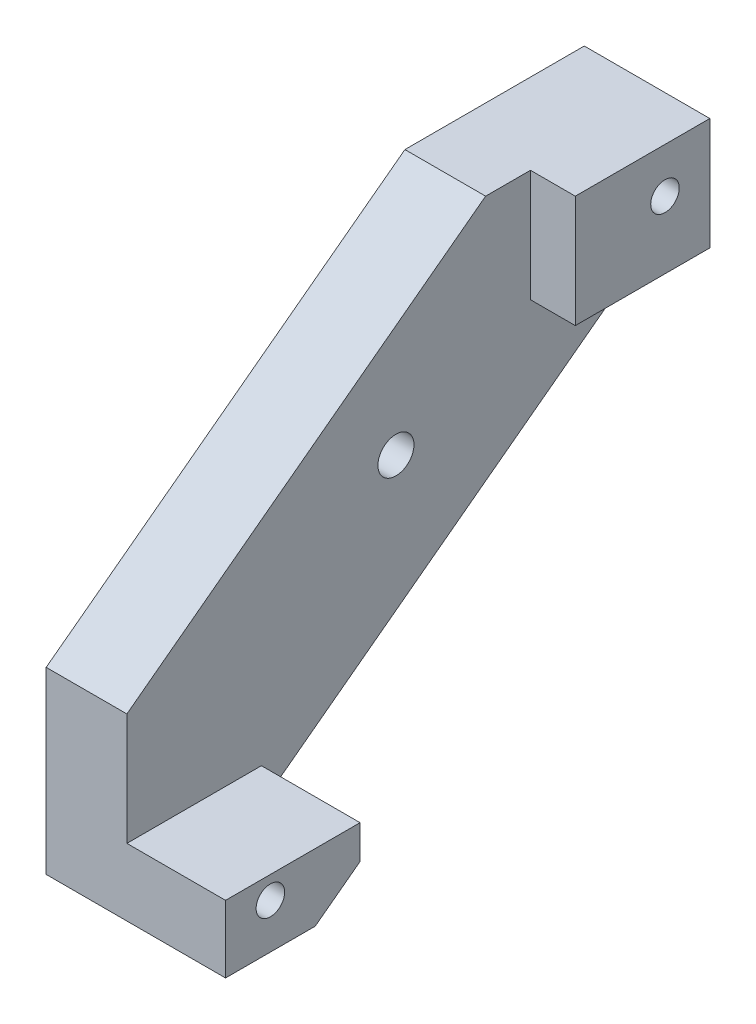
from build123d import *

# Parameters (mm, degrees)
SKETCH1_W                   = 76.2
SKETCH1_H                   = 63.5
BOSS_EXTRUDE1_DEPTH         = 25.4
SKETCH2_W                   = 38.1
SKETCH2_H                   = 63.5
CUT_EXTRUDE1_DEPTH          = 13.97
F_1_4_20_TAPPED_HOLE1_D     = 5.1054
F_1_4_20_TAPPED_HOLE1_DEPTH = 19.05
F_1_4_20_TAPPED_HOLE1_TIP   = 1.533816902
LPATTERN1_COUNT             = 2
LPATTERN1_PITCH             = 50.8
LPATTERN1_COUNT_DIR2        = 2
LPATTERN1_PITCH_DIR2        = 63.5
SKETCH7_W                   = 76.2
SKETCH7_H                   = 38.1
CUT_EXTRUDE2_DEPTH          = 13.97
SKETCH8_OUTSIDE_W           = 98.678
SKETCH8_OUTSIDE_H           = 85.978
CUT_EXTRUDE3_DEPTH          = 56.72102386
SKETCH9_W                   = 7.62
SKETCH9_H                   = 15.875
CUT_EXTRUDE4_DEPTH          = 87.36933773


with BuildPart() as part:
    # Sketch1 → Boss-Extrude1 (new body)
    with BuildSketch(Plane(origin=(0, 0, 0), x_dir=(0, 0, -1), z_dir=(1, 0, 0))):
        Rectangle(SKETCH1_W, SKETCH1_H)
    extrude(amount=BOSS_EXTRUDE1_DEPTH)

    # Sketch2 → Cut-Extrude1 (cut)
    with BuildSketch(Plane(origin=(25.4, 0, 0), x_dir=(0, 0, -1), z_dir=(1, 0, 0))):
        Rectangle(SKETCH2_W, SKETCH2_H)
    extrude(amount=-CUT_EXTRUDE1_DEPTH, mode=Mode.SUBTRACT)

    # Sketch5 → #10-32 Tapped Hole1 (revolve, cut)
    with BuildSketch(Plane(origin=(25.4, 25.4, 31.75), x_dir=(0, 0, -1), z_dir=(0, 1, 0))):
        Polygon((0, 0), (0, 14.929317848), (2.0193, 13.716), (2.0193, 0), align=None)
    f_10_32_tapped_hole1 = revolve(axis=Axis((31.75, 25.4, 31.75), (-1, 0, 0)), mode=Mode.SUBTRACT)

    # 1/4-20 Tapped Hole1
    with Locations(Plane(origin=(11.43, 0, 0), x_dir=(0, 0, -1), z_dir=(1, 0, 0))):
        with Locations((0, 6.35)):
            Hole(F_1_4_20_TAPPED_HOLE1_D / 2, depth=F_1_4_20_TAPPED_HOLE1_DEPTH)
            with Locations((0, 0, -(F_1_4_20_TAPPED_HOLE1_DEPTH + F_1_4_20_TAPPED_HOLE1_TIP / 2))):  # 118° drill point
                Cone(0, F_1_4_20_TAPPED_HOLE1_D / 2, F_1_4_20_TAPPED_HOLE1_TIP, mode=Mode.SUBTRACT)

    # LPattern1: 10-32 Tapped Hole1 2 × 2
    with Locations(*[(0, -i * LPATTERN1_PITCH, -j * LPATTERN1_PITCH_DIR2) for i in range(LPATTERN1_COUNT) for j in range(LPATTERN1_COUNT_DIR2) if (i, j) != (0, 0)]):
        add(f_10_32_tapped_hole1, mode=Mode.SUBTRACT)

    # Sketch7 → Cut-Extrude2 (cut)
    with BuildSketch(Plane(origin=(25.4, 0, 0), x_dir=(0, 0, -1), z_dir=(1, 0, 0))):
        with Locations((0, -3.175)):
            Rectangle(SKETCH7_W, SKETCH7_H)
    extrude(amount=-CUT_EXTRUDE2_DEPTH, mode=Mode.SUBTRACT)

    # Sketch8 outside → Cut-Extrude3 (cut, through all)
    with BuildSketch(Plane.ZY):
        Rectangle(SKETCH8_OUTSIDE_W, SKETCH8_OUTSIDE_H)
        Polygon((-38.1, 15.875), (25.4, -31.75), (38.1, -31.75), (39.3192, -7.2644), (-12.7, 31.75), (-38.1, 31.75), align=None, mode=Mode.SUBTRACT)
    extrude(amount=-CUT_EXTRUDE3_DEPTH, mode=Mode.SUBTRACT)

    # Sketch9 → Cut-Extrude4 (cut, through all)
    with BuildSketch(Plane(origin=(0, 0, -38.1), x_dir=(-1, 0, 0), z_dir=(0, 0, -1))):
        with Locations((-21.59, 23.8125)):
            Rectangle(SKETCH9_W, SKETCH9_H)
    extrude(amount=-CUT_EXTRUDE4_DEPTH, mode=Mode.SUBTRACT)


solid = part.part
